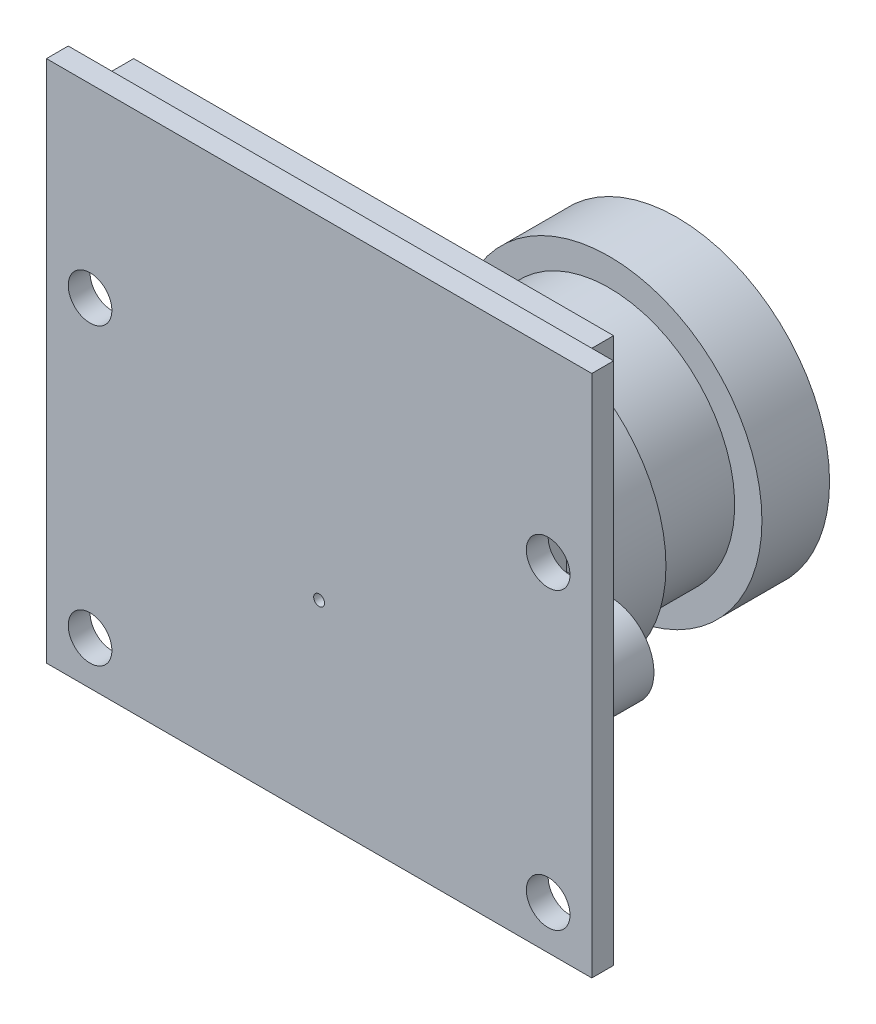
from build123d import *

# Parameters (mm, degrees)
SKETCH_1_W             = 25
SKETCH_1_H             = 24
EXTRUDE_271_DEPTH      = 1
EXTRUDE_458_DEPTH      = 3.8
SKETCH_3_W             = 22
SKETCH_3_H             = 4.802295703
EXTRUDE_725_DEPTH      = 1.5
HOLE_WIZARD_886_D      = 0.5
HOLE_WIZARD_886_DEPTH  = 1
HOLE_WIZARD_1548_D     = 2
HOLE_WIZARD_1548_DEPTH = 16.4


with BuildPart() as part:
    # Эскиз1 → Extrude 271 (new body)
    with BuildSketch(Plane(origin=(0, 0, -1), x_dir=(-1, 0, 0), z_dir=(0, 0, -1))):
        with Locations((-12.5, 12)):
            Rectangle(SKETCH_1_W, SKETCH_1_H)
    extrude(amount=-EXTRUDE_271_DEPTH)

    # Эскиз2 → Extrude 458 (add)
    with BuildSketch(Plane(origin=(0, 0, -1), x_dir=(-1, 0, 0), z_dir=(0, 0, -1))):
        with BuildLine():
            Line((-5.95, 10.75), (-3.949995117, 10.75))
            ThreePointArc((-3.949995117, 10.75), (-1.949995117, 8.75), (-3.949995117, 6.75))
            Line((-3.949995117, 6.75), (-5.95, 6.75))
            Line((-5.95, 6.75), (-5.95, 2.2))
            Line((-5.95, 2.2), (-19.05, 2.2))
            Line((-19.05, 2.2), (-19.05, 6.75))
            Line((-19.05, 6.75), (-21.050009766, 6.75))
            ThreePointArc((-21.050009766, 6.75), (-23.050009766, 8.75), (-21.050009766, 10.75))
            Line((-21.050009766, 10.75), (-19.05, 10.75))
            Line((-19.05, 10.75), (-19.05, 15.3))
            Line((-19.05, 15.3), (-5.95, 15.3))
            Line((-5.95, 15.3), (-5.95, 10.75))
        make_face()
    extrude(amount=EXTRUDE_458_DEPTH)

    # Эскиз3 → Extrude 725 (add)
    with BuildSketch(Plane(origin=(0, 0, -1), x_dir=(-1, 0, 0), z_dir=(0, 0, -1))):
        with Locations((-12.5, 21.098852149)):
            Rectangle(SKETCH_3_W, SKETCH_3_H)
    extrude(amount=EXTRUDE_725_DEPTH)

    # Эскиз4 → Revolve 834 (revolve)
    with BuildSketch(Plane.XZ.offset(-8.75), mode=Mode.PRIVATE) as revolve_834_sk:
        Polygon((19.1, -4.8), (12.5, -4.8), (12.5, -16.4), (19.5, -16.4), (19.5, -13.3), (18.25, -13.3), (18.25, -9.3), (19.1, -9.3), align=None)
    revolve(revolve_834_sk.sketch.rotate(Axis((12.5, 8.75, -4.8), (0, 0, -1)), 180), axis=Axis((12.5, 8.75, -4.8), (0, 0, -1)))

    # Hole Wizard 886
    with Locations(Plane.XY):
        with Locations((12.5, 8.75)):
            Hole(HOLE_WIZARD_886_D / 2, depth=HOLE_WIZARD_886_DEPTH)

    # Hole Wizard 1548
    with Locations(Plane.XY):
        with Locations((2, 2), (2, 15.5), (23, 15.5), (23, 2)):
            Hole(HOLE_WIZARD_1548_D / 2, depth=HOLE_WIZARD_1548_DEPTH)


solid = part.part
